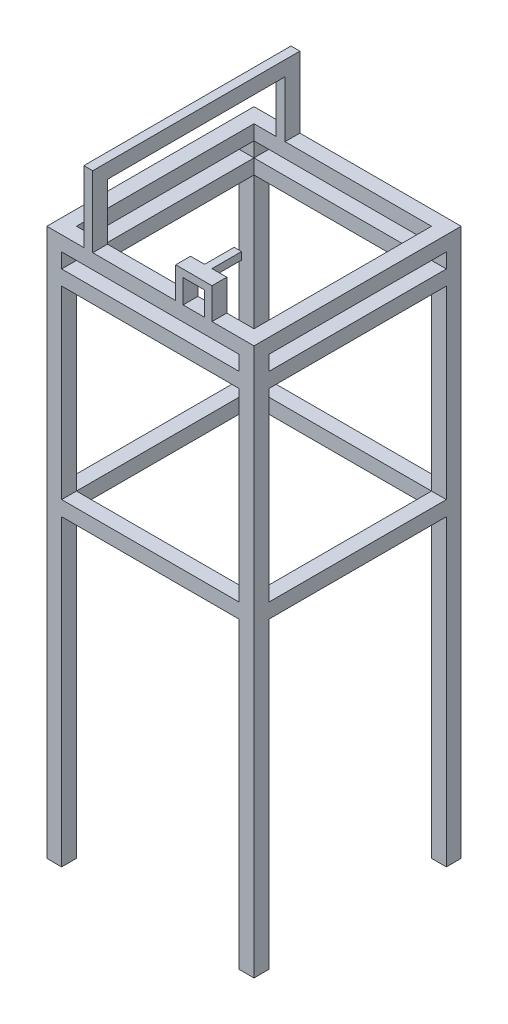
from build123d import *

# Parameters (mm, degrees)
CROQUIS1_W              = 700
CROQUIS1_H              = 700
CROQUIS1_W_2            = 600
CROQUIS1_H_2            = 600
SALIENTE_EXTRUIR1_DEPTH = 50
CROQUIS2_W              = 50
CROQUIS2_H              = 50
SALIENTE_EXTRUIR2_DEPTH = 1800
CROQUIS3_W              = 700
CROQUIS3_H              = 700
CROQUIS3_W_2            = 600
CROQUIS3_H_2            = 600
SALIENTE_EXTRUIR3_DEPTH = 50
CROQUIS4_W              = 700
CROQUIS4_H              = 700
CROQUIS4_W_2            = 600
CROQUIS4_H_2            = 600
SALIENTE_EXTRUIR4_DEPTH = 50
CROQUIS6_W              = 122.530736156
CROQUIS6_H              = 155
CROQUIS6_W_2            = 72.530736156
CROQUIS6_H_2            = 80
SALIENTE_EXTRUIR5_DEPTH = 50
CROQUIS7_W              = 25
CROQUIS7_H              = 25
SALIENTE_EXTRUIR6_DEPTH = 100
SALIENTE_EXTRUIR7_DEPTH = 15


with BuildPart() as part:
    # Croquis1 → Saliente-Extruir1 (new body)
    with BuildSketch(Plane(origin=(0, 0, 0), x_dir=(1, 0, 0), z_dir=(0, 1, 0))):
        with Locations((300, 300)):
            Rectangle(CROQUIS1_W, CROQUIS1_H)
        with Locations((300, 300)):
            Rectangle(CROQUIS1_W_2, CROQUIS1_H_2, mode=Mode.SUBTRACT)
    extrude(amount=SALIENTE_EXTRUIR1_DEPTH)

    # Croquis2 → Saliente-Extruir2 (add)
    with BuildSketch(Plane.XZ):
        with Locations((625, 25)):
            Rectangle(CROQUIS2_W, CROQUIS2_H)
        with Locations((-25, 25)):
            Rectangle(CROQUIS2_W, CROQUIS2_H)
        with Locations((-25, -625)):
            Rectangle(CROQUIS2_W, CROQUIS2_H)
        with Locations((625, -625)):
            Rectangle(CROQUIS2_W, CROQUIS2_H)
    extrude(amount=SALIENTE_EXTRUIR2_DEPTH)

    # Croquis3 → Saliente-Extruir3 (add)
    with BuildSketch(Plane(origin=(0, -725, 0), x_dir=(-1, 0, 0), z_dir=(0, -1, 0))):
        with Locations((-300, 300)):
            Rectangle(CROQUIS3_W, CROQUIS3_H)
        with Locations((-300, 300)):
            Rectangle(CROQUIS3_W_2, CROQUIS3_H_2, mode=Mode.SUBTRACT)
    extrude(amount=SALIENTE_EXTRUIR3_DEPTH)

    # Croquis4 → Saliente-Extruir4 (add)
    with BuildSketch(Plane(origin=(0, -50, 0), x_dir=(-1, 0, 0), z_dir=(0, -1, 0))):
        with Locations((-300, 300)):
            Rectangle(CROQUIS4_W, CROQUIS4_H)
        with Locations((-300, 300)):
            Rectangle(CROQUIS4_W_2, CROQUIS4_H_2, mode=Mode.SUBTRACT)
    extrude(amount=SALIENTE_EXTRUIR4_DEPTH)

    # Croquis6 → Saliente-Extruir5 (add)
    with BuildSketch(Plane.XY.offset(50)):
        with Locations((446.741550776, 77.5)):
            Rectangle(CROQUIS6_W, CROQUIS6_H)
        with Locations((446.741550776, 90)):
            Rectangle(CROQUIS6_W_2, CROQUIS6_H_2, mode=Mode.SUBTRACT)
    extrude(amount=-SALIENTE_EXTRUIR5_DEPTH)

    # Croquis7 → Saliente-Extruir6 (add)
    with BuildSketch(Plane(origin=(0, 0, 0), x_dir=(-1, 0, 0), z_dir=(0, 0, -1))):
        with Locations((-445.476182698, 142.5)):
            Rectangle(CROQUIS7_W, CROQUIS7_H)
    extrude(amount=SALIENTE_EXTRUIR6_DEPTH)

    # Croquis9 → Saliente-Extruir7 (add, symmetric)
    with BuildSketch(Plane.ZY.offset(-90)):
        Polygon((0, 50), (50, 50), (50, 290), (-650, 290), (-650, 50), (-600, 50), (-600, 240), (0, 240), align=None)
    extrude(amount=SALIENTE_EXTRUIR7_DEPTH, both=True)


solid = part.part
